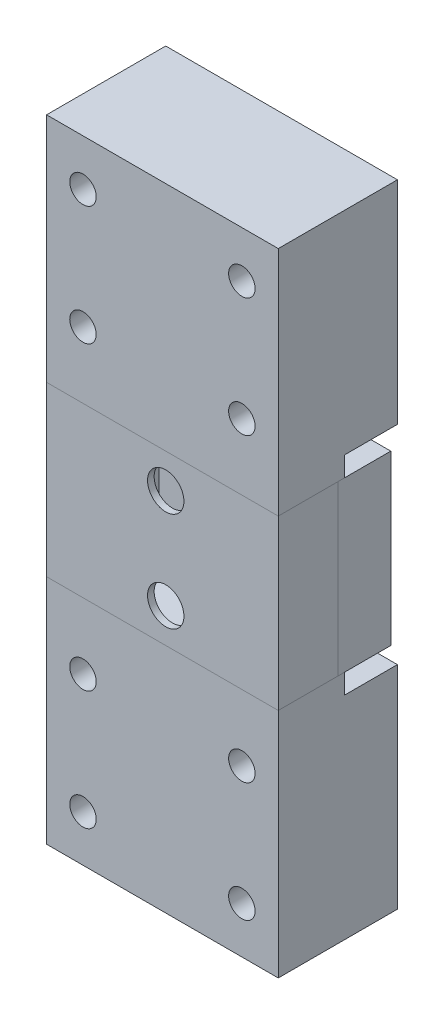
from build123d import *

# Parameters (mm, degrees)
SKETCH2_W             = 35
SKETCH2_H             = 25.429203673
SKETCH2_R             = 2.75
BOSS_EXTRUDE1_DEPTH   = 8
SKETCH3_W             = 8
SKETCH3_H             = 25.429203673
BOSS_EXTRUDE2_DEPTH   = 8
BOSS_EXTRUDE2_2_DEPTH = 8
SKETCH4_W             = 35
SKETCH4_H             = 17
BOSS_EXTRUDE3_DEPTH   = 35
SKETCH5_W             = 35
SKETCH5_H             = 32
BOSS_EXTRUDE4_DEPTH   = 8
SKETCH7_R             = 2
CUT_EXTRUDE2_DEPTH    = 246.857049231
SKETCH6_W             = 35
SKETCH6_H             = 7
CUT_EXTRUDE1_DEPTH    = 257.615924903


with BuildPart() as part:
    # Sketch2 → Boss-Extrude1 (new body)
    with BuildSketch(Plane.XY):
        with Locations((219.5, 12.714601836)):
            Rectangle(SKETCH2_W, SKETCH2_H)
        with Locations((220, 5.2)):
            Circle(SKETCH2_R, mode=Mode.SUBTRACT)
        with Locations((220, 20.229203673)):
            Circle(SKETCH2_R, mode=Mode.SUBTRACT)
    boss_extrude1 = extrude(amount=BOSS_EXTRUDE1_DEPTH)


with BuildPart() as body_2:
    # Sketch3 → Boss-Extrude2 (new body)
    with BuildSketch(Plane.XY.offset(8)):
        with Locations((233, 12.714601836)):
            Rectangle(SKETCH3_W, SKETCH3_H)
    extrude(amount=BOSS_EXTRUDE2_DEPTH)



with BuildPart() as body_3:
    # Sketch3 → Boss-Extrude2 2 (new body)
    with BuildSketch(Plane.XY.offset(8)):
        with Locations((206, 12.714601836)):
            Rectangle(SKETCH3_W, SKETCH3_H)
    extrude(amount=BOSS_EXTRUDE2_2_DEPTH)


with BuildPart() as body_2_1:
    add(body_2.part)

    add(body_3.part)  # Mirror1 merges body 3
    # Mirror1: Boss-Extrude1 across plane
    add(boss_extrude1.mirror(Plane.XY.offset(12)))


with BuildPart() as body_3_2:
    # Sketch4 → Boss-Extrude3 (new body)
    with BuildSketch(Plane(origin=(0, 25.429203673, 0), x_dir=(1, 0, 0), z_dir=(0, 1, 0))):
        with Locations((219.5, -15.5)):
            Rectangle(SKETCH4_W, SKETCH4_H)
    extrude(amount=BOSS_EXTRUDE3_DEPTH)

    # Sketch5 → Boss-Extrude4 (add)
    with BuildSketch(Plane(origin=(0, 0, 7), x_dir=(-1, 0, 0), z_dir=(0, 0, -1))):
        with Locations((-219.5, 44.429203673)):
            Rectangle(SKETCH5_W, SKETCH5_H)
    extrude(amount=BOSS_EXTRUDE4_DEPTH)

    # Sketch7 → Cut-Extrude2 (cut, through all)
    with BuildSketch(Plane(origin=(0, 0, -1), x_dir=(-1, 0, 0), z_dir=(0, 0, -1))):
        with Locations((-231.5, 53.429203673)):
            Circle(SKETCH7_R)
        with Locations((-231.5, 35.429203673)):
            Circle(SKETCH7_R)
        with Locations((-207.5, 35.429203673)):
            Circle(SKETCH7_R)
        with Locations((-207.5, 53.429203673)):
            Circle(SKETCH7_R)
    extrude(amount=-CUT_EXTRUDE2_DEPTH, mode=Mode.SUBTRACT)


with BuildPart() as body_4:
    # Mirror2: mirrored copy
    add(body_3_2.part.mirror(Plane(origin=(0, 12.714601837, 0), x_dir=(0, 0, 1), z_dir=(0, -1, 0))))


with BuildPart() as cut_extrude1_tool:
    # Sketch6 → Cut-Extrude1 (new, through all)
    with BuildSketch(Plane(origin=(0, 60.429203673, 0), x_dir=(1, 0, 0), z_dir=(0, 1, 0))):
        with Locations((219.5, -20.5)):
            Rectangle(SKETCH6_W, SKETCH6_H)
    extrude(amount=-CUT_EXTRUDE1_DEPTH)


with BuildPart() as body_2_2:
    add(body_2_1.part)

    # Cut-Extrude1: cut by cut_extrude1_tool
    add(cut_extrude1_tool.part, mode=Mode.SUBTRACT)


with BuildPart() as body_3_2_1:
    add(body_3_2.part)

    # Cut-Extrude1: cut by cut_extrude1_tool
    add(cut_extrude1_tool.part, mode=Mode.SUBTRACT)


with BuildPart() as body_4_1:
    add(body_4.part)

    # Cut-Extrude1: cut by cut_extrude1_tool
    add(cut_extrude1_tool.part, mode=Mode.SUBTRACT)


solid = Compound([part.part, body_2_2.part, body_3_2_1.part, body_4_1.part])
